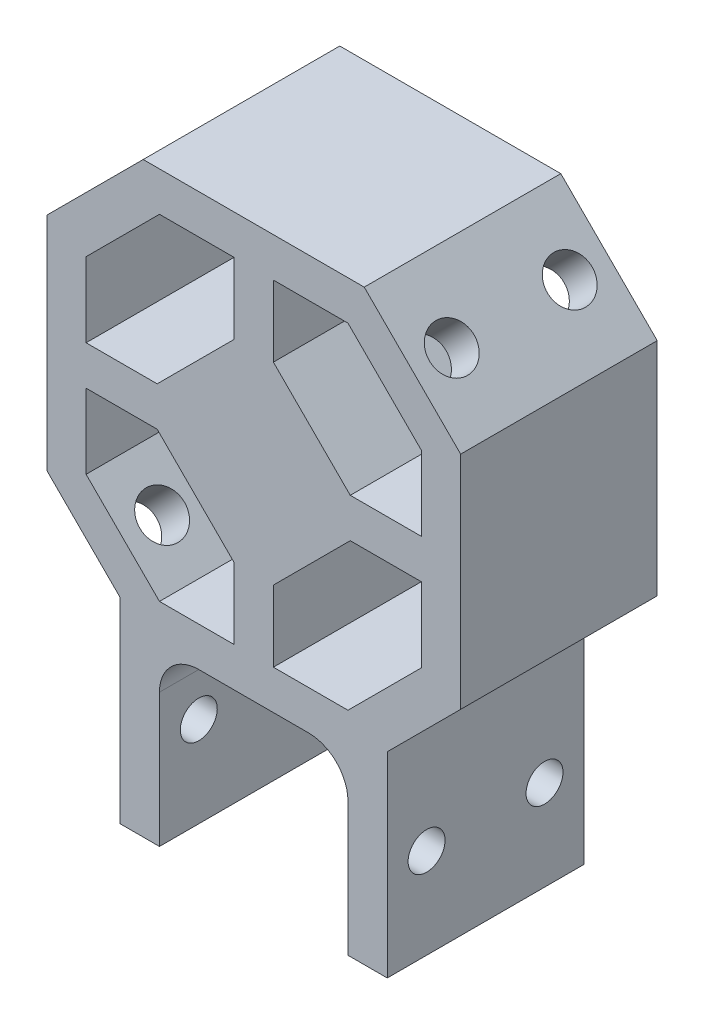
from build123d import *

# Parameters (mm, degrees)
EXTRUDE_THIN1_DEPTH = 25
SKETCH5_W           = 23.970919882
SKETCH5_H           = 5
BOSS_EXTRUDE2_DEPTH = 25
BOSS_EXTRUDE3_DEPTH = 25
SKETCH6_R           = 2.85
CUT_EXTRUDE1_DEPTH  = 5
SKETCH9_R           = 2.85
CUT_EXTRUDE2_DEPTH  = 5
CUT_EXTRUDE3_START  = -5
SKETCH10_R          = 2.85
CUT_EXTRUDE3_DEPTH  = 5
CUT_EXTRUDE4_START  = -5
SKETCH11_R          = 2.85
CUT_EXTRUDE4_DEPTH  = 5
FILLET1_R           = 5
CUT_EXTRUDE5_REACH  = 91.834
SKETCH12_R          = 2.35


with BuildPart() as part:
    # Sketch1 → Extrude-Thin1 (new body)
    with BuildSketch(Plane.XY):
        Polygon((11.985459941, 0), (11.985459941, 26.992888143), (21.319269453, 36.326697654), (21.319269453, 60.297617537), (11.985459941, 69.631427048), (-11.985459941, 69.631427048), (-21.319269453, 60.297617537), (-21.319269453, 36.326697654), (-11.985459941, 26.992888143), (-11.985459941, 0), (-16.985459941, 0), (-16.985459941, 24.921820331), (-26.319269453, 34.255629842), (-26.319269453, 62.368685348), (-14.056527753, 74.631427048), (14.056527753, 74.631427048), (26.319269453, 62.368685348), (26.319269453, 34.255629842), (16.985459941, 24.921820331), (16.985459941, 0), align=None)
    extrude(amount=-EXTRUDE_THIN1_DEPTH)

    # Sketch5 → Boss-Extrude2 (add)
    with BuildSketch(Plane.XY):
        with Locations((0, 24.492888143)):
            Rectangle(SKETCH5_W, SKETCH5_H)
    extrude(amount=-BOSS_EXTRUDE2_DEPTH)

    # Sketch3 → Boss-Extrude3 (add)
    with BuildSketch(Plane.XY):
        Polygon((-2.5, 36.033625869), (-2.5, 26.992888143), (2.5, 26.992888143), (2.5, 36.033625869), (2.899137803, 36.432763672), (11.879393924, 45.413019793), (12.278531727, 45.812157595), (21.319269453, 45.812157595), (21.319269453, 50.812157595), (12.278531727, 50.812157595), (11.879393924, 51.211295398), (2.899137803, 60.191551519), (2.5, 60.590689322), (2.5, 69.631427048), (-2.5, 69.631427048), (-2.5, 60.590689322), (-2.899137803, 60.191551519), (-12.278531727, 50.812157595), (-21.319269453, 50.812157595), (-21.319269453, 45.812157595), (-12.278531727, 45.812157595), (-2.899137803, 36.432763672), align=None)
    extrude(amount=-BOSS_EXTRUDE3_DEPTH)

    # Sketch6 → Cut-Extrude1 (cut)
    with BuildSketch(Plane(origin=(3.968180195, 3.968180195, 0), x_dir=(0, 0, 1), z_dir=(-0.7071067811865479, -0.7071067811865471, 0))):
        with Locations(Location((-20, 34.161854249, 0), (0, 0, 270))):
            Circle(SKETCH6_R)
        with Locations(Location((-5, 34.161854249, 0), (0, 0, 270))):
            Circle(SKETCH6_R)
    extrude(amount=-CUT_EXTRUDE1_DEPTH, mode=Mode.SUBTRACT)

    # Sketch9 → Cut-Extrude2 (cut)
    with BuildSketch(Plane(origin=(-3.968180195, 3.968180195, 0), x_dir=(0, 0, 1), z_dir=(0.7071067811865479, -0.7071067811865471, 0))):
        with Locations(Location((-20, -34.161854249, 0), (0, 0, 270))):
            Circle(SKETCH9_R)
        with Locations(Location((-5, -34.161854249, 0), (0, 0, 270))):
            Circle(SKETCH9_R)
    extrude(amount=-CUT_EXTRUDE2_DEPTH, mode=Mode.SUBTRACT)

    # Sketch10 → Cut-Extrude3 (cut)
    with BuildSketch(Plane(origin=(-44.343977401, 44.343977401, 0), x_dir=(0, 0, 1), z_dir=(-0.7071067811865471, 0.707106781186548, 0)).offset(CUT_EXTRUDE3_START)):
        with Locations(Location((-20, 34.161854249, 0), (0, 0, 90))):
            Circle(SKETCH10_R)
        with Locations(Location((-5, 34.161854249, 0), (0, 0, 90))):
            Circle(SKETCH10_R)
    extrude(amount=CUT_EXTRUDE3_DEPTH, mode=Mode.SUBTRACT)

    # Sketch11 → Cut-Extrude4 (cut)
    with BuildSketch(Plane(origin=(44.343977401, 44.343977401, 0), x_dir=(0, 0, -1), z_dir=(0.7071067811865471, 0.707106781186548, 0)).offset(CUT_EXTRUDE4_START)):
        with Locations(Location((5, 34.161854249, 0), (0, 0, 270))):
            Circle(SKETCH11_R)
        with Locations(Location((20, 34.161854249, 0), (0, 0, 270))):
            Circle(SKETCH11_R)
    extrude(amount=CUT_EXTRUDE4_DEPTH, mode=Mode.SUBTRACT)

    # Fillet1
    fillet1_edges = [part.edges().sort_by_distance(p)[0] for p in [
        (11.985459941, 21.992888143, -12.5),
        (-11.985459941, 21.992888143, -12.5),
    ]]
    fillet(fillet1_edges, radius=FILLET1_R)

    # Cut-Extrude5: up to this face of the body (flat: up to its plane)
    cut_extrude5_end = Plane(part.part.faces().sort_by_distance((-16.985459941, 12.460910165, -12.5))[0])
    # Sketch12 → Cut-Extrude5 (cut, up to the picked face)
    with BuildSketch(Plane(origin=(16.985459941, 0, 0), x_dir=(0, 0, -1), z_dir=(1, 0, 0)), mode=Mode.PRIVATE) as cut_extrude5_sk1:
        with Locations(Location((20, 11.5, 0), (0, 0, 90))):
            Circle(SKETCH12_R)
    cut_extrude5_tool1 = split(extrude(cut_extrude5_sk1.sketch, amount=-CUT_EXTRUDE5_REACH, mode=Mode.PRIVATE), bisect_by=cut_extrude5_end, keep=Keep.BOTH, mode=Mode.PRIVATE)
    # Sketch12 → Cut-Extrude5 (cut, up to the picked face)
    with BuildSketch(Plane(origin=(16.985459941, 0, 0), x_dir=(0, 0, -1), z_dir=(1, 0, 0)), mode=Mode.PRIVATE) as cut_extrude5_sk2:
        with Locations(Location((5, 11.5, 0), (0, 0, 90))):
            Circle(SKETCH12_R)
    cut_extrude5_tool2 = split(extrude(cut_extrude5_sk2.sketch, amount=-CUT_EXTRUDE5_REACH, mode=Mode.PRIVATE), bisect_by=cut_extrude5_end, keep=Keep.BOTH, mode=Mode.PRIVATE)
    add(cut_extrude5_tool1.solids().sort_by(Axis((16.98546, 11.5, -20), (-1, 0, 0)))[0], mode=Mode.SUBTRACT)
    add(cut_extrude5_tool2.solids().sort_by(Axis((16.98546, 11.5, -5), (-1, 0, 0)))[0], mode=Mode.SUBTRACT)


solid = part.part
